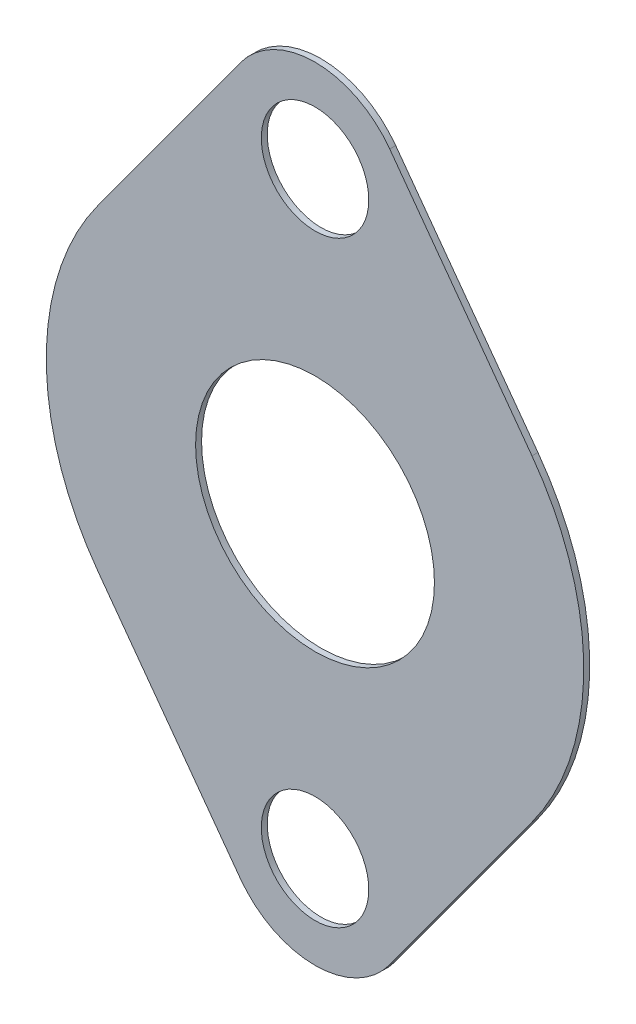
from build123d import *

# Parameters (mm, degrees)
SKETCH1_R      = 20
SKETCH1_R_2    = 9
EXTRUDE1_DEPTH = 1


with BuildPart() as part:
    # Sketch1 → Extrude1 (new body)
    with BuildSketch(Plane.XY):
        with BuildLine():
            Line((-12.514750297, 59.145), (-36.333146024, 26.55))
            ThreePointArc((-36.333146024, 26.55), (-45, 0), (-36.333146024, -26.55))
            Line((-36.333146024, -26.55), (-12.514750297, -59.145))
            ThreePointArc((-12.514750297, -59.145), (0, -65.5), (12.514750297, -59.145))
            Line((12.514750297, -59.145), (36.333146024, -26.55))
            ThreePointArc((36.333146024, -26.55), (45, 0), (36.333146024, 26.55))
            Line((36.333146024, 26.55), (12.514750297, 59.145))
            ThreePointArc((12.514750297, 59.145), (0, 65.5), (-12.514750297, 59.145))
        make_face()
        Circle(SKETCH1_R, mode=Mode.SUBTRACT)
        with Locations((0, -50)):
            Circle(SKETCH1_R_2, mode=Mode.SUBTRACT)
        with Locations((0, 50)):
            Circle(SKETCH1_R_2, mode=Mode.SUBTRACT)
    extrude(amount=EXTRUDE1_DEPTH)


solid = part.part
